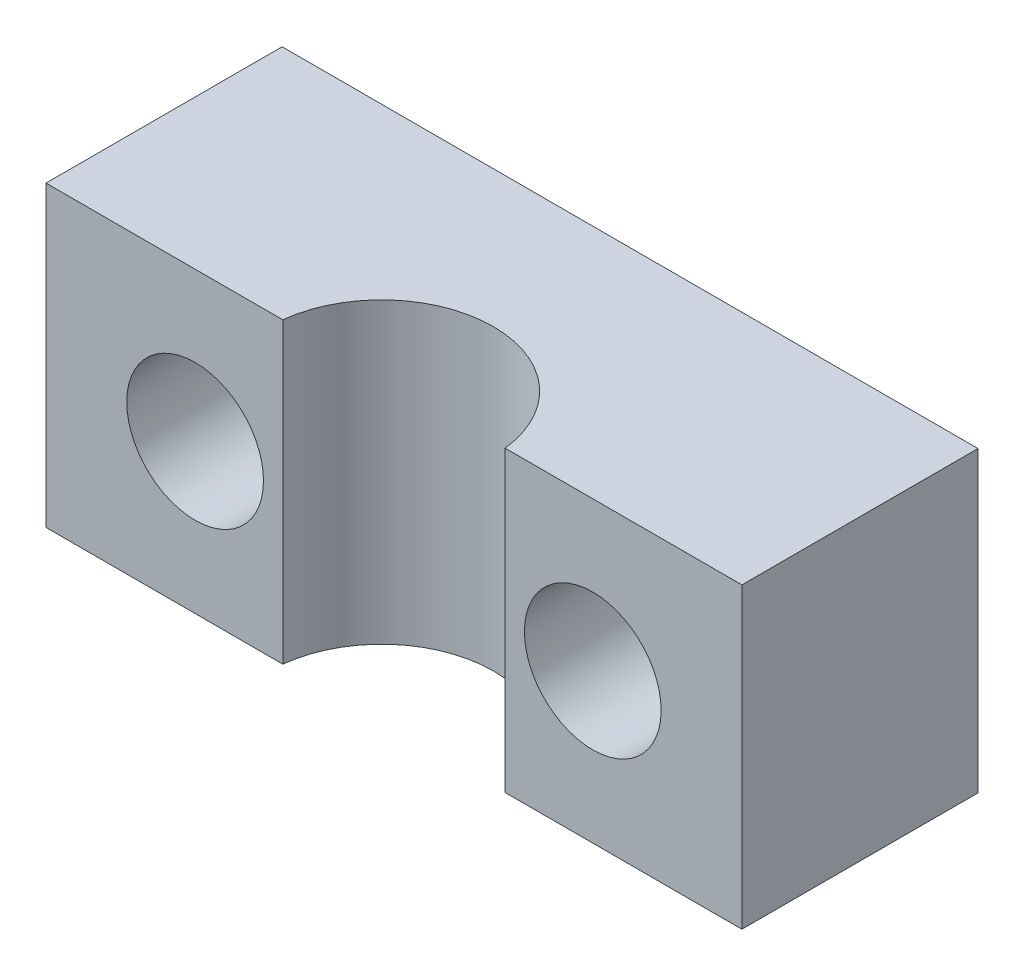
from build123d import *

# Parameters (mm, degrees)
SKETCH_1_W          = 28
SKETCH_1_H          = 12
SKETCH_1_R          = 2.75
EXTRUDE_1_DEPTH     = 9.5
SKETCH_2_R          = 4.75
CUT_EXTRUDE_2_DEPTH = 5
SKETCH_3_R          = 4.5
CUT_EXTRUDE_3_DEPTH = 1281.252706776


with BuildPart() as part:
    # 草图1 → 拉伸1 (new body)
    with BuildSketch(Plane.XY):
        with Locations((1266.161217663, 1010.158991307)):
            Rectangle(SKETCH_1_W, SKETCH_1_H)
        with Locations((1274.161217663, 1010.158991307)):
            Circle(SKETCH_1_R, mode=Mode.SUBTRACT)
        with Locations((1258.161217663, 1010.158991307)):
            Circle(SKETCH_1_R, mode=Mode.SUBTRACT)
    extrude(amount=EXTRUDE_1_DEPTH)

    # 草图2 → 拉伸2 (cut)
    with BuildSketch(Plane(origin=(0, 0, 0), x_dir=(-1, 0, 0), z_dir=(0, 0, -1))):
        with Locations((-1258.161217663, 1010.158991307)):
            Circle(SKETCH_2_R)
        with Locations((-1274.161217663, 1010.158991307)):
            Circle(SKETCH_2_R)
    extrude(amount=-CUT_EXTRUDE_2_DEPTH, mode=Mode.SUBTRACT)

    # 草图3 → 拉伸3 (cut, through all)
    with BuildSketch(Plane(origin=(0, 1016.158991307, 0), x_dir=(1, 0, 0), z_dir=(0, 1, 0))):
        with Locations((1266.161217663, -10)):
            Circle(SKETCH_3_R)
    extrude(amount=-CUT_EXTRUDE_3_DEPTH, mode=Mode.SUBTRACT)


solid = part.part
